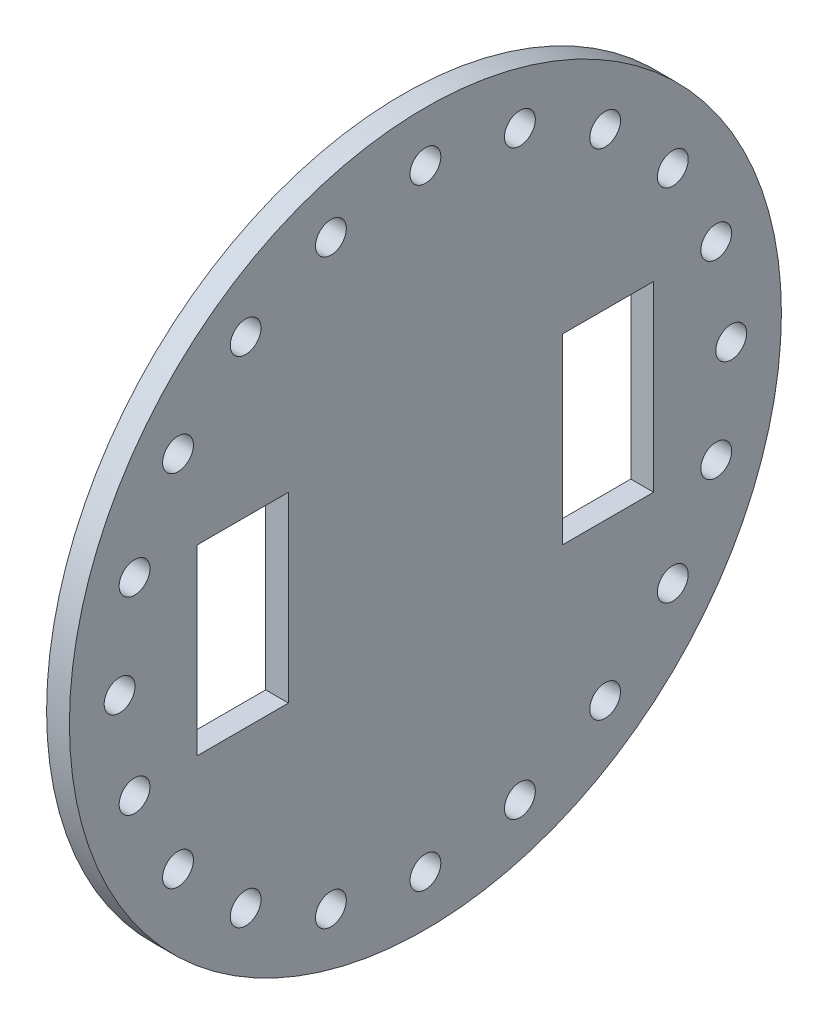
from build123d import *

# Parameters (mm, degrees)
ESQUISSE1_R        = 156
ESQUISSE1_R_2      = 6.75
ESQUISSE1_W        = 40
ESQUISSE1_H        = 80
BOSS_EXTRU_1_DEPTH = 10


with BuildPart() as part:
    # Esquisse1 → Boss.-Extru.1 (new body)
    with BuildSketch(Plane(origin=(0, 0, 0), x_dir=(0, 0, -1), z_dir=(1, 0, 0))):
        Circle(ESQUISSE1_R)
        with Locations((-78.763223807, -108.408277246)):
            Circle(ESQUISSE1_R_2, mode=Mode.SUBTRACT)
        with Locations((-108.408277246, -78.763223807)):
            Circle(ESQUISSE1_R_2, mode=Mode.SUBTRACT)
        with Locations((-41.408277246, -127.441573184)):
            Circle(ESQUISSE1_R_2, mode=Mode.SUBTRACT)
        with Locations((0, -134)):
            Circle(ESQUISSE1_R_2, mode=Mode.SUBTRACT)
        with Locations((-127.441573184, -41.408277246)):
            Circle(ESQUISSE1_R_2, mode=Mode.SUBTRACT)
        with Locations((41.408277246, -127.441573184)):
            Circle(ESQUISSE1_R_2, mode=Mode.SUBTRACT)
        with Locations((78.763223807, -108.408277246)):
            Circle(ESQUISSE1_R_2, mode=Mode.SUBTRACT)
        with Locations((108.408277246, -78.763223807)):
            Circle(ESQUISSE1_R_2, mode=Mode.SUBTRACT)
        with Locations((127.441573184, -41.408277246)):
            Circle(ESQUISSE1_R_2, mode=Mode.SUBTRACT)
        with Locations((-134, 0)):
            Circle(ESQUISSE1_R_2, mode=Mode.SUBTRACT)
        with Locations((-80, 0)):
            Rectangle(ESQUISSE1_W, ESQUISSE1_H, mode=Mode.SUBTRACT)
        with Locations((-127.441573184, 41.408277246)):
            Circle(ESQUISSE1_R_2, mode=Mode.SUBTRACT)
        with Locations((-108.408277246, 78.763223807)):
            Circle(ESQUISSE1_R_2, mode=Mode.SUBTRACT)
        with Locations((-78.763223807, 108.408277246)):
            Circle(ESQUISSE1_R_2, mode=Mode.SUBTRACT)
        with Locations((-41.408277246, 127.441573184)):
            Circle(ESQUISSE1_R_2, mode=Mode.SUBTRACT)
        with Locations((80, 0)):
            Rectangle(ESQUISSE1_W, ESQUISSE1_H, mode=Mode.SUBTRACT)
        with Locations((134, 0)):
            Circle(ESQUISSE1_R_2, mode=Mode.SUBTRACT)
        with Locations((127.441573184, 41.408277246)):
            Circle(ESQUISSE1_R_2, mode=Mode.SUBTRACT)
        with Locations((0, 134)):
            Circle(ESQUISSE1_R_2, mode=Mode.SUBTRACT)
        with Locations((41.408277246, 127.441573184)):
            Circle(ESQUISSE1_R_2, mode=Mode.SUBTRACT)
        with Locations((108.408277246, 78.763223807)):
            Circle(ESQUISSE1_R_2, mode=Mode.SUBTRACT)
        with Locations((78.763223807, 108.408277246)):
            Circle(ESQUISSE1_R_2, mode=Mode.SUBTRACT)
    extrude(amount=BOSS_EXTRU_1_DEPTH)


solid = part.part
